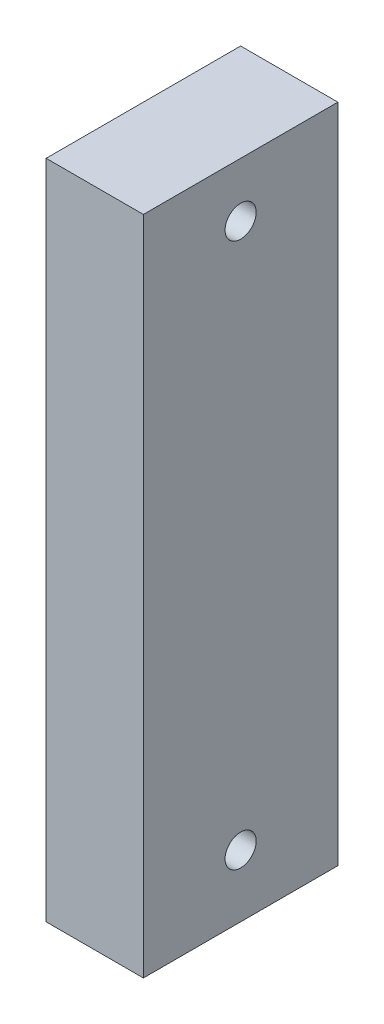
from build123d import *

# Parameters (mm, degrees)
SKETCH1_W           = 25
SKETCH1_H           = 170
BOSS_EXTRUDE1_DEPTH = 50
SKETCH3_R           = 4
CUT_EXTRUDE1_DEPTH  = 179.955301682


with BuildPart() as part:
    # Sketch1 → Boss-Extrude1 (new body)
    with BuildSketch(Plane.XY):
        with Locations((12.5, 85)):
            Rectangle(SKETCH1_W, SKETCH1_H)
    extrude(amount=BOSS_EXTRUDE1_DEPTH)

    # Sketch3 → Cut-Extrude1 (cut, through all)
    with BuildSketch(Plane.ZY):
        with Locations((25, 16)):
            Circle(SKETCH3_R)
        with Locations((25, 156)):
            Circle(SKETCH3_R)
    extrude(amount=-CUT_EXTRUDE1_DEPTH, mode=Mode.SUBTRACT)


solid = part.part
